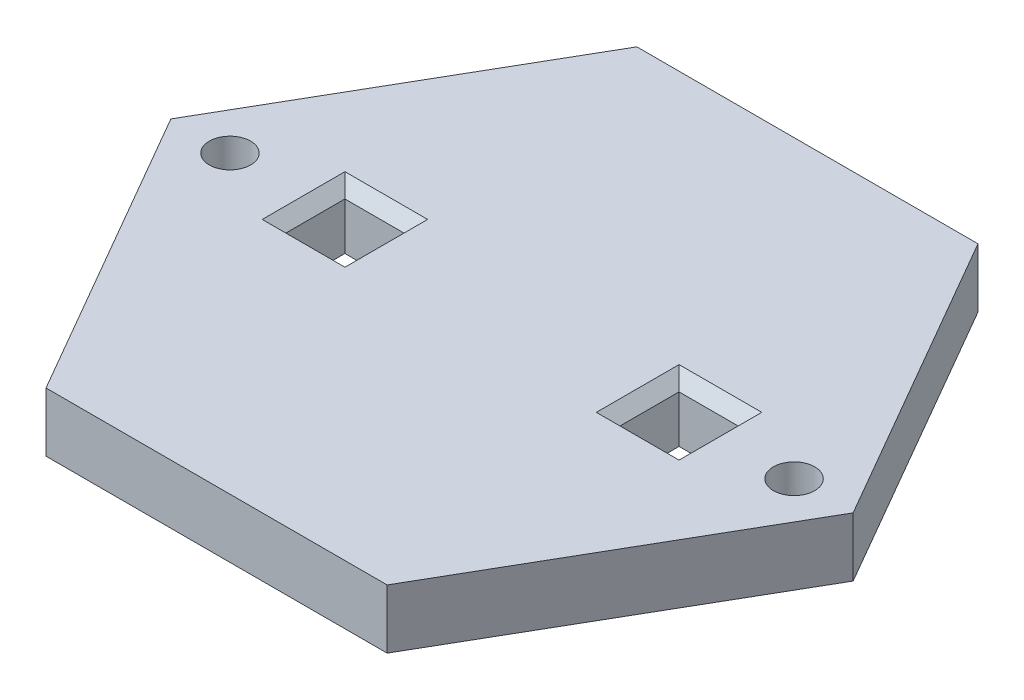
from build123d import *

# Parameters (mm, degrees)
BOSS_EXTRUDE1_DEPTH = 5
SKETCH2_R           = 1.75
SKETCH2_W           = 5
SKETCH2_H           = 5
CUT_EXTRUDE1_DEPTH  = 5
CHAMFER1_SIZE       = 1


with BuildPart() as part:
    # Sketch1 → Boss-Extrude1 (new body)
    with BuildSketch(Plane(origin=(0, 0, 0), x_dir=(1, 0, 0), z_dir=(0, 1, 0))):
        Polygon((-28.867513459, 0), (-14.43375673, -25), (14.43375673, -25), (28.867513459, 0), (14.43375673, 25), (-14.43375673, 25), align=None)
    extrude(amount=BOSS_EXTRUDE1_DEPTH)

    # Sketch2 → Cut-Extrude1 (cut)
    with BuildSketch(Plane(origin=(0, 5, 0), x_dir=(1, 0, 0), z_dir=(0, 1, 0))):
        with Locations(Location((-23.867513459, 0, 0), (0, 0, 270))):
            Circle(SKETCH2_R)
        with Locations(Location((23.867513459, 0, 0), (0, 0, 270))):
            Circle(SKETCH2_R)
        with Locations((-14.137513459, 0)):
            Rectangle(SKETCH2_W, SKETCH2_H)
        with Locations((14.137513459, 0)):
            Rectangle(SKETCH2_W, SKETCH2_H)
    extrude(amount=-CUT_EXTRUDE1_DEPTH, mode=Mode.SUBTRACT)

    # Chamfer1
    chamfer1_edges = [part.edges().sort_by_distance(p)[0] for p in [
        (-11.637513459, 5, 0),
        (-14.137513459, 5, -2.5),
        (-16.637513459, 5, 0),
        (-14.137513459, 5, 2.5),
        (16.637513459, 5, 0),
        (14.137513459, 5, -2.5),
        (11.637513459, 5, 0),
        (14.137513459, 5, 2.5),
    ]]
    chamfer(chamfer1_edges, length=CHAMFER1_SIZE)


solid = part.part
